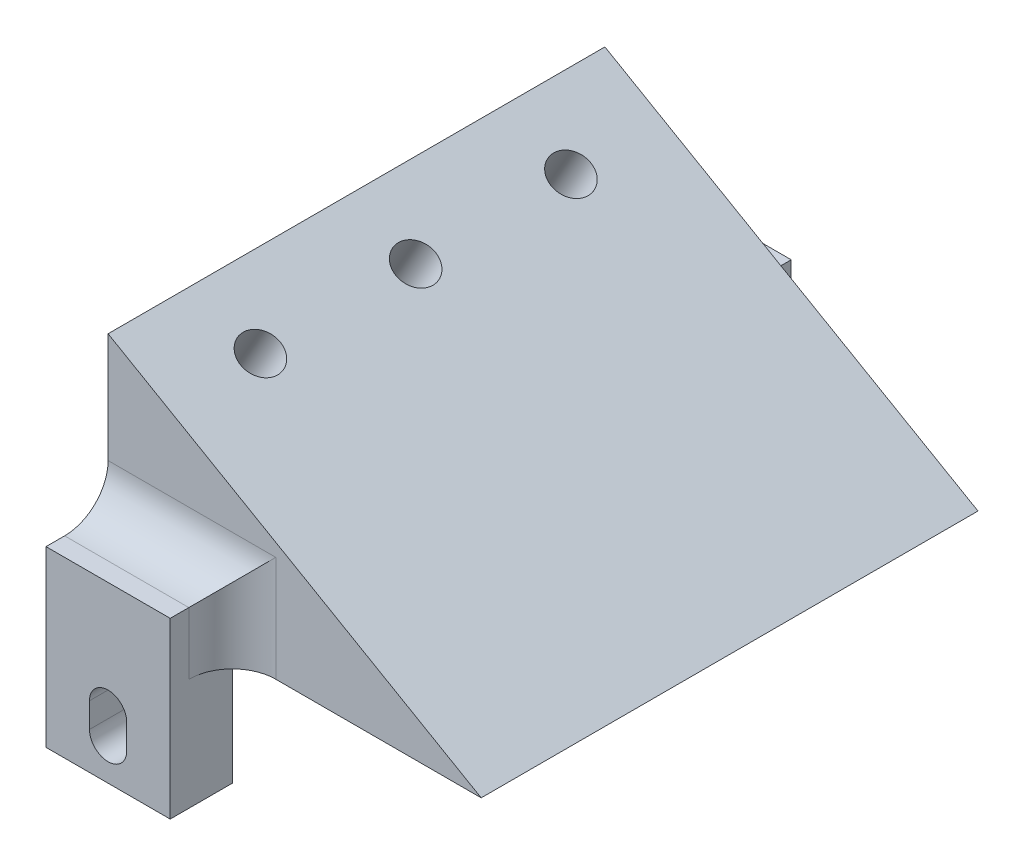
from build123d import *

# Parameters (mm, degrees)
BOSS_EXTRUDE1_DEPTH = 80
SKETCH2_W           = 20
SKETCH2_H           = 28
BOSS_EXTRUDE2_DEPTH = 10
FILLET1_R           = 7
CUT_EXTRUDE1_DEPTH  = 20
FILLET2_R           = 7
SKETCH4_R           = 3.2
CUT_EXTRUDE2_DEPTH  = 9.5


with BuildPart() as part:
    # Sketch1 → Boss-Extrude1 (new body)
    with BuildSketch(Plane.XY):
        Polygon((0, 0), (0, 34.685337878), (60.076767483, 0), align=None)
    extrude(amount=BOSS_EXTRUDE1_DEPTH)

    # Sketch2 → Boss-Extrude2 (add)
    with BuildSketch(Plane.XY.offset(80)):
        with Locations((10, -4)):
            Rectangle(SKETCH2_W, SKETCH2_H)
    boss_extrude2 = extrude(amount=BOSS_EXTRUDE2_DEPTH)

    # Fillet1
    fillet1_edges = [part.edges().sort_by_distance(p)[0] for p in [
        (20, 5, 80),
        (10, 10, 80),
    ]]
    fillet(fillet1_edges, radius=FILLET1_R)

    # Sketch3 → Cut-Extrude1 (cut)
    with BuildSketch(Plane.XY.offset(90)):
        with BuildLine():
            Line((7, -12), (7, -8))
            ThreePointArc((7, -8), (10, -5), (13, -8))
            Line((13, -8), (13, -12))
            ThreePointArc((13, -12), (10, -15), (7, -12))
        make_face()
    cut_extrude1 = extrude(amount=-CUT_EXTRUDE1_DEPTH, mode=Mode.SUBTRACT)

    # Mirror10: Boss-Extrude2, Cut-Extrude1 across plane
    add(boss_extrude2.mirror(Plane(origin=(0, 0, 40), x_dir=(1, 0, 0), z_dir=(0, 0, -1))))
    add(cut_extrude1.mirror(Plane(origin=(0, 0, 40), x_dir=(1, 0, 0), z_dir=(0, 0, -1))), mode=Mode.SUBTRACT)

    # Fillet2
    fillet2_edges = [part.edges().sort_by_distance(p)[0] for p in [
        (20, 5, 0),
        (10, 10, 0),
    ]]
    fillet(fillet2_edges, radius=FILLET2_R)

    # Sketch4 → Cut-Extrude2 (cut)
    with BuildSketch(Plane(origin=(15.019191871, 26.014003409, 0), x_dir=(0.8660254037844418, -0.49999999999999456, 0), z_dir=(0.4999999999999946, 0.8660254037844419, 0))):
        with Locations(Location((-6.342668939, -15, 0), (0, 0, 180))):
            Circle(SKETCH4_R)
        with Locations(Location((-6.342668939, -40, 0), (0, 0, 180))):
            Circle(SKETCH4_R)
        with Locations(Location((-6.342668939, -65, 0), (0, 0, 180))):
            Circle(SKETCH4_R)
    extrude(amount=-CUT_EXTRUDE2_DEPTH, mode=Mode.SUBTRACT)


solid = part.part
